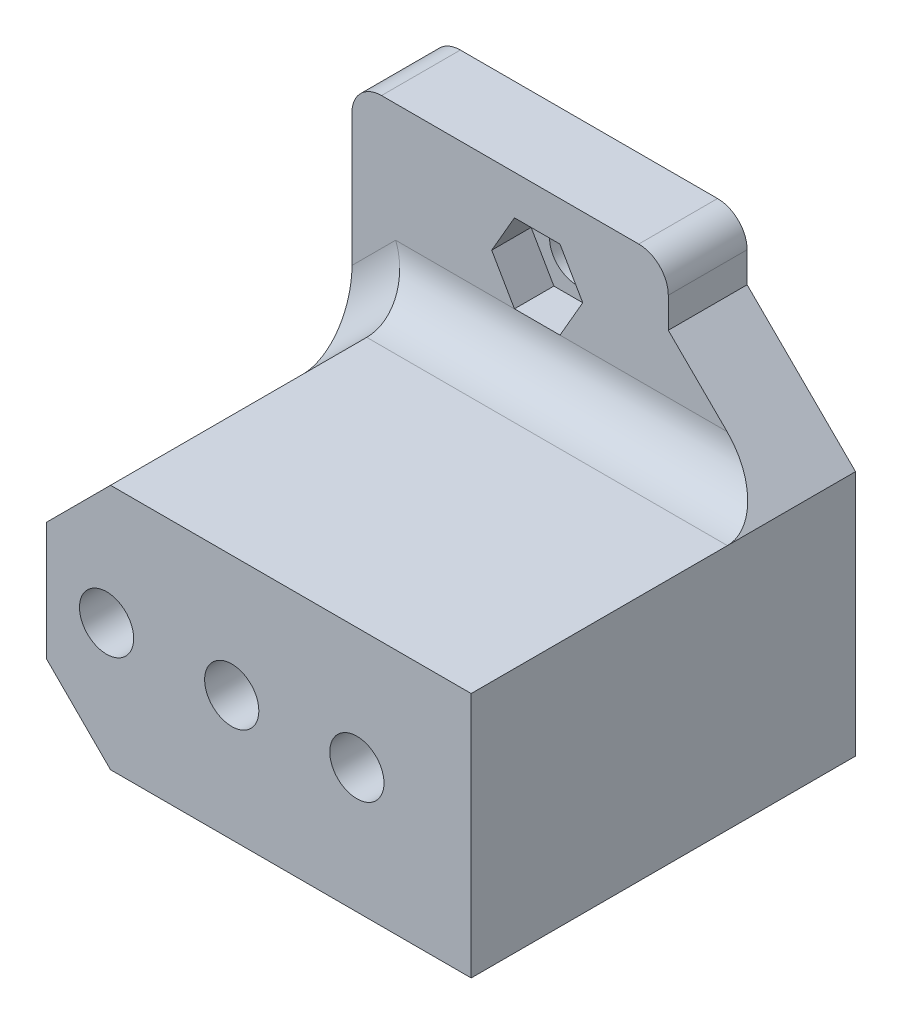
from build123d import *

# Parameters (mm, degrees)
SKETCH1_R           = 2.75
BOSS_EXTRUDE1_DEPTH = 8
SKETCH2_W           = 43.1
SKETCH2_H           = 25
SKETCH2_R           = 2.75
BOSS_EXTRUDE2_DEPTH = 31
CHAMFER1_SIZE       = 6.5
FILLET1_R           = 5
CUT_EXTRUDE1_DEPTH  = 4
FILLET2_R           = 3


with BuildPart() as part:
    # Sketch1 → Boss-Extrude1 (new body)
    with BuildSketch(Plane.XY):
        Polygon((0, 0), (-43.1, 0), (-43.1, 42), (-11, 42), (-11, 35.920164834), (0, 25), align=None)
        with Locations((-11.6, 12.7)):
            Circle(SKETCH1_R, mode=Mode.SUBTRACT)
        with Locations((-24.3, 12.7)):
            Circle(SKETCH1_R, mode=Mode.SUBTRACT)
        with Locations((-37, 12.7)):
            Circle(SKETCH1_R, mode=Mode.SUBTRACT)
        with Locations((-24.3, 34)):
            Circle(SKETCH1_R, mode=Mode.SUBTRACT)
    extrude(amount=BOSS_EXTRUDE1_DEPTH)

    # Sketch2 → Boss-Extrude2 (add)
    with BuildSketch(Plane.XY.offset(8)):
        with Locations((-21.55, 12.5)):
            Rectangle(SKETCH2_W, SKETCH2_H)
        with Locations((-11.6, 12.7)):
            Circle(SKETCH2_R, mode=Mode.SUBTRACT)
        with Locations((-24.3, 12.7)):
            Circle(SKETCH2_R, mode=Mode.SUBTRACT)
        with Locations((-37, 12.7)):
            Circle(SKETCH2_R, mode=Mode.SUBTRACT)
    extrude(amount=BOSS_EXTRUDE2_DEPTH)

    # Chamfer1
    chamfer1_edges = [part.edges().sort_by_distance(p)[0] for p in [
        (-43.1, 0, 19.5),
        (-43.1, 25, 23.5),
    ]]
    chamfer(chamfer1_edges, length=CHAMFER1_SIZE)

    # Fillet1
    fillet1_edges = [part.edges().sort_by_distance(p)[0] for p in [
        (-18.3, 25, 8),
        (-39.85, 21.75, 8),
    ]]
    fillet(fillet1_edges, radius=FILLET1_R)

    # Sketch3 → Cut-Extrude1 (cut)
    with BuildSketch(Plane.XY.offset(8)):
        Polygon((-19.681197846, 34), (-21.990598923, 38), (-26.609401077, 38), (-28.918802154, 34), (-26.609401077, 30), (-21.990598923, 30), align=None)
    extrude(amount=-CUT_EXTRUDE1_DEPTH, mode=Mode.SUBTRACT)

    # Fillet2
    fillet2_edges = [part.edges().sort_by_distance(p)[0] for p in [
        (-43.1, 42, 4),
        (-11, 42, 4),
    ]]
    fillet(fillet2_edges, radius=FILLET2_R)


solid = part.part
